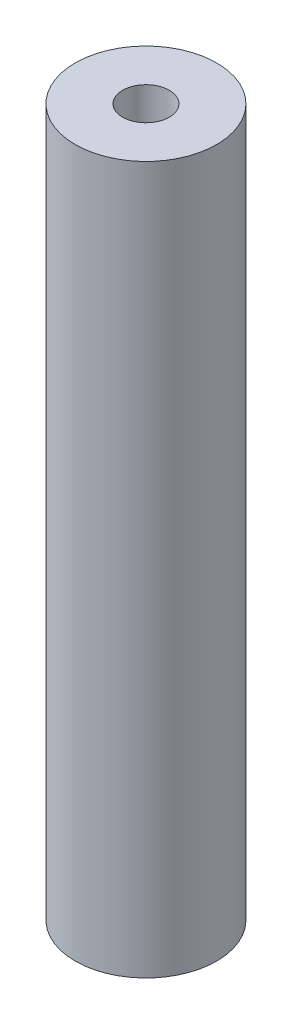
from build123d import *

# Parameters (mm, degrees)
SKETCH_1_R      = 5
EXTRUDE_1_DEPTH = 25


with BuildPart() as part:
    # 草图1 → 凸台-拉伸1 (new, symmetric)
    with BuildSketch(Plane(origin=(0, 0, 0), x_dir=(1, 0, 0), z_dir=(0, 1, 0))):
        with Locations(Location((0, 0, 0), (0, 0, 270))):
            Circle(SKETCH_1_R)
    extrude(amount=EXTRUDE_1_DEPTH, both=True)

    # 草图4 → M4 螺纹孔1 (revolve, cut)
    with BuildSketch(Plane(origin=(0, 25, 0), x_dir=(0, 0, 1), z_dir=(1, 0, 0))):
        Polygon((0, 0), (0, 12.491420021), (1.65, 11.5), (1.65, 0), align=None)
    hole_wizard_m4_1 = revolve(axis=Axis((0, 31.35, 0), (0, -1, 0)), mode=Mode.SUBTRACT)

    # 镜向1: M4 螺纹孔1 across plane
    add(hole_wizard_m4_1.mirror(Plane.ZX), mode=Mode.SUBTRACT)


solid = part.part
